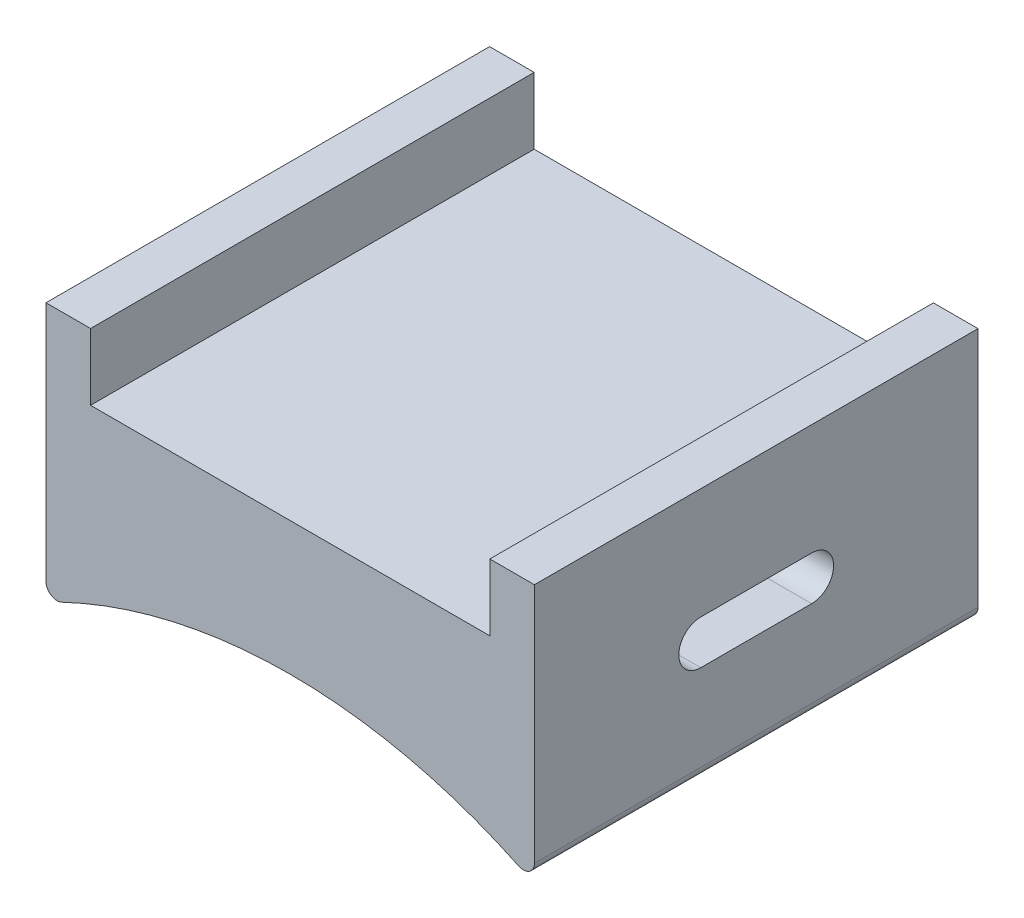
from build123d import *

# Parameters (mm, degrees)
BOSS_EXTRUDE1_DEPTH = 20
CUT_EXTRUDE1_DEPTH  = 22.02


with BuildPart() as part:
    # Sketch1 → Boss-Extrude1 (new body)
    with BuildSketch(Plane.XY):
        with BuildLine():
            Line((-9, 3), (9, 3))
            Line((9, 3), (9, 6))
            Line((9, 6), (11.01, 6))
            Line((11.01, 6), (11.01, -4.883887969))
            ThreePointArc((11.01, -4.883887969), (10.776588402, -5.306889889), (10.294277504, -5.334957592))
            ThreePointArc((10.294277504, -5.334957592), (0, -3), (-10.294277504, -5.334957592))
            ThreePointArc((-10.294277504, -5.334957592), (-10.776588402, -5.306889889), (-11.01, -4.883887969))
            Line((-11.01, -4.883887969), (-11.01, 6))
            Line((-11.01, 6), (-9, 6))
            Line((-9, 6), (-9, 3))
        make_face()
    extrude(amount=BOSS_EXTRUDE1_DEPTH)

    # Sketch2 → Cut-Extrude1 (cut)
    with BuildSketch(Plane(origin=(11.01, 0, 0), x_dir=(0, 0, -1), z_dir=(1, 0, 0))):
        with BuildLine():
            Line((-12.5, 0.99), (-7.5, 0.99))
            ThreePointArc((-7.5, 0.99), (-6.51, 0), (-7.5, -0.99))
            Line((-7.5, -0.99), (-12.5, -0.99))
            ThreePointArc((-12.5, -0.99), (-13.49, 0), (-12.5, 0.99))
        make_face()
    extrude(amount=-CUT_EXTRUDE1_DEPTH, mode=Mode.SUBTRACT)


solid = part.part
